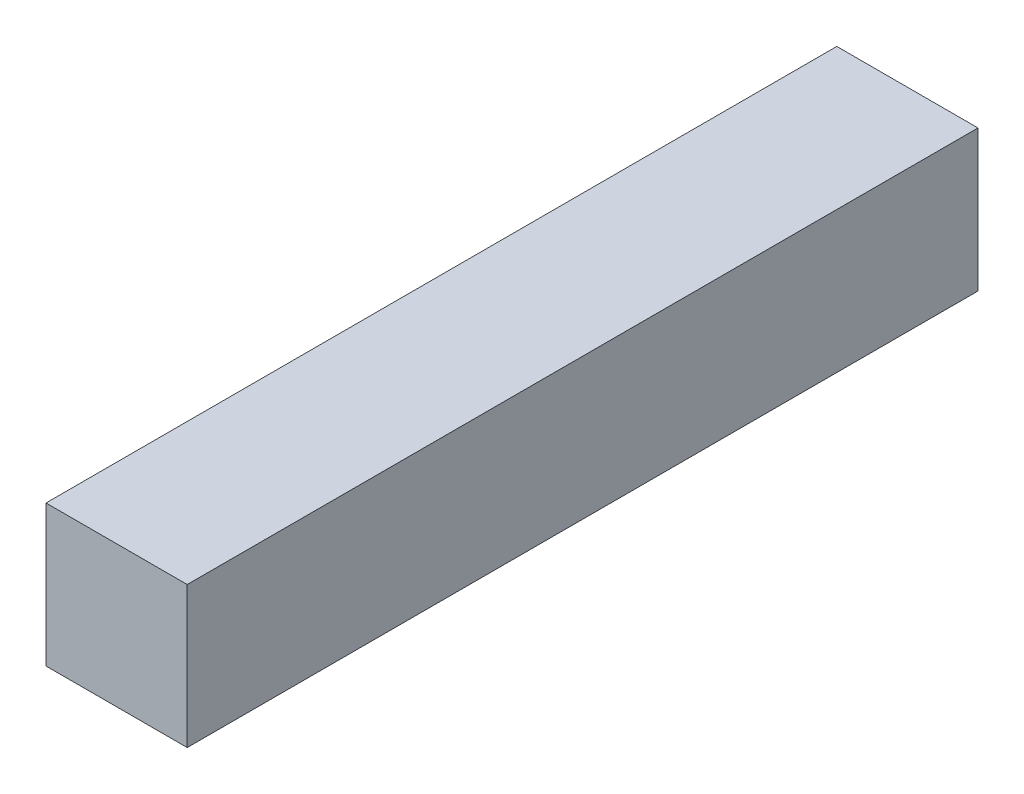
from build123d import *

# Parameters (mm, degrees)
SKETCH1_W           = 3.175
SKETCH1_H           = 3.175
BOSS_EXTRUDE1_DEPTH = 17.78


with BuildPart() as part:
    # Sketch1 → Boss-Extrude1 (new body)
    with BuildSketch(Plane.XY):
        with Locations((1.5875, 1.5875)):
            Rectangle(SKETCH1_W, SKETCH1_H)
    extrude(amount=BOSS_EXTRUDE1_DEPTH)


solid = part.part
